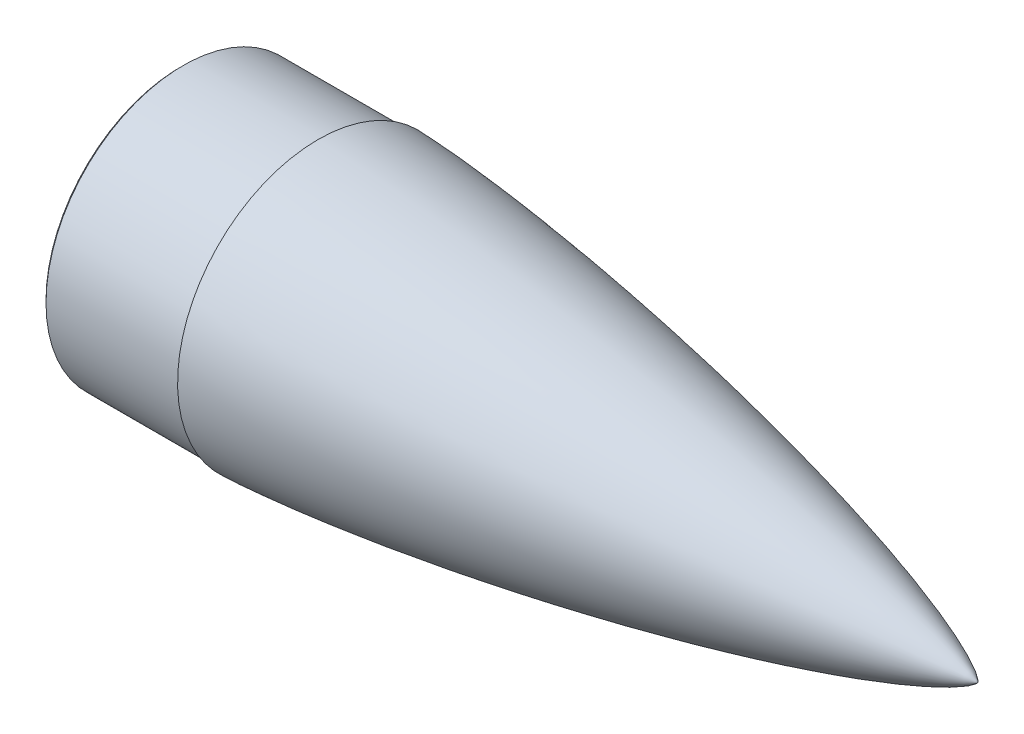
from build123d import *

# Parameters (mm, degrees)
CHAMFER1_SIZE     = 1.5
CIRPATTERN1_COUNT = 6


with BuildPart() as part:
    # Sketch10 → Revolve1 (revolve)
    with BuildSketch(Plane.XY, mode=Mode.PRIVATE) as revolve1_sk:
        with BuildLine():
            Line((11.112493743, 81.99983), (11.112493743, 67.49983))
            Line((11.112493743, 67.49983), (129.304508698, 67.49983))
            add(Edge.make_bspline(
                [(368.967251823, 0), (368.965299543, 0.012338489), (368.959416882, 0.036518378), (368.940636147, 0.082964007), (368.902304552, 0.158736421), (368.845538097, 0.250270687), (368.755690124, 0.376555746), (368.616653262, 0.54835284), (368.392888737, 0.793577299), (368.008659121, 1.164904965), (367.344738263, 1.729853685), (366.176060796, 2.601559154), (364.09282389, 3.960032328), (360.425978756, 6.040734396), (354.402196649, 9.01831007), (344.042994901, 13.507695011), (329.152005398, 19.128483965), (310.425167902, 25.398569259), (288.741266406, 31.933693508), (266.378532845, 38.106125474), (243.901379123, 43.846895186), (221.331994001, 49.212017941), (198.683967629, 54.234500927), (175.966897581, 58.934255644), (156.034567874, 62.771715365), (141.509051931, 65.395628269), (132.679425236, 66.924517444), (129.562757302, 67.455859883), (129.304508698, 67.49983)],
                knots=[0, 0, 0, 0, 0, 0.000134949, 0.000269899, 0.000539798, 0.000919537, 0.001299277, 0.001947431, 0.00293136, 0.004511869, 0.007081312, 0.011380263, 0.018707867, 0.031423867, 0.052705479, 0.084103008, 0.140910136, 0.203703492, 0.266497064, 0.329290816, 0.392084375, 0.454877964, 0.517671564, 0.580465191, 0.643258828, 0.674655593, 0.677492072, 0.677492072, 0.677492072, 0.677492072, 0.677492072], degree=4))
            Line((368.967251823, 0), (408.967251823, 0))
            add(Edge.make_bspline(
                [(408.967251823, 0), (408.964913524, 0.013501739), (408.958040758, 0.039916077), (408.936520441, 0.090485698), (408.892222076, 0.174057132), (408.826281575, 0.275556803), (408.721696416, 0.415833756), (408.561101809, 0.605075245), (408.30561918, 0.87242415), (407.86966713, 1.275299562), (407.120955138, 1.885142115), (405.803773451, 2.82590185), (403.46240692, 4.287152794), (399.325294488, 6.531818454), (392.481146888, 9.758904649), (380.662076725, 14.628008466), (363.637187185, 20.711720382), (342.215241093, 27.476512989), (317.428462321, 34.49762647), (291.879335737, 41.10482439), (266.21046092, 47.228993169), (240.44548836, 52.933436777), (214.598861982, 58.255439009), (188.68089566, 63.217582693), (165.946174917, 67.253280679), (146.421982586, 70.493799722), (130.127893898, 73.044947468), (117.078590637, 74.994157933), (104.015464216, 76.84854079), (92.573263959, 78.384492045), (82.757139441, 79.635603973), (74.571340184, 80.632219902), (68.019260454, 81.400804211), (61.463723364, 82.139375899), (54.90469802, 82.84637726), (48.342159918, 83.519940506), (41.776057559, 84.15778717), (36.02754108, 84.682157239), (31.097921259, 85.105234912), (26.988317923, 85.438669825), (23.699666618, 85.693218594), (20.085807822, 85.958448038), (16.719873821, 86.189018485), (13.602098287, 86.386966779), (10.732704013, 86.554575744), (8.436635008, 86.678703291), (6.139997341, 86.792157585), (4.129892063, 86.879313264), (2.40653858, 86.944618982), (1.257348635, 86.979022496), (0.68269791, 86.99491462), (0.395312527, 86.99983)],
                knots=[0, 0, 0, 0, 0, 0.000130123, 0.000260245, 0.000520491, 0.000900391, 0.00128029, 0.001925099, 0.002881508, 0.004418208, 0.006927086, 0.011110697, 0.018279138, 0.03067276, 0.051704469, 0.08310228, 0.139908797, 0.202702513, 0.265496165, 0.328289682, 0.391083359, 0.453876973, 0.516670577, 0.579464197, 0.642257765, 0.673654596, 0.705051427, 0.736448267, 0.767845106, 0.799241874, 0.814940257, 0.830638641, 0.846337073, 0.862035505, 0.877733936, 0.893432368, 0.90913072, 0.924829072, 0.932678248, 0.940527424, 0.9483766, 0.956225776, 0.967169332, 0.97264111, 0.978112888, 0.983584666, 0.989056444, 0.994528222, 0.997264111, 1, 1, 1, 1, 1], degree=4))
            Line((0.395312527, 86.99983), (0.395312527, 84.99983))
            Line((0.395312527, 84.99983), (-84.604517473, 84.99983))
            Line((-84.604517473, 84.99983), (-84.604517473, 81.99983))
            Line((-84.604517473, 81.99983), (11.112493743, 81.99983))
        make_face()
    revolve(revolve1_sk.sketch.rotate(Axis((46.917858469, 0, 0), (-1, 0, 0)), 90), axis=Axis((46.917858469, 0, 0), (-1, 0, 0)))

    # Chamfer1
    chamfer1_edges = [part.edges().sort_by_distance(p)[0] for p in [
        (-84.604517473, 0, 84.99983),
    ]]
    chamfer(chamfer1_edges, length=CHAMFER1_SIZE)

    # Sketch18 → Tapped Hole for M4x0.7 Helicoil1 (revolve, cut)
    with BuildSketch(Plane(origin=(11.112493743, 64.735251709, -37.374915), x_dir=(0, 0, 1), z_dir=(0, 1, 0))):
        Polygon((0, 0), (0, 31.2618073), (2.1, 30), (2.1, 0), align=None)
    tapped_hole_for_m4x0_7_helicoil1 = revolve(axis=Axis((4.762493743, 64.735251709, -37.374915), (1, 0, 0)), mode=Mode.SUBTRACT)

    # CirPattern1: Tapped Hole for M4x0.7 Helicoil1 ×6 about axis
    cirpattern1_axis = Axis((0, 0, 0), (1, 0, 0))
    for i in range(1, CIRPATTERN1_COUNT):
        add(tapped_hole_for_m4x0_7_helicoil1.rotate(cirpattern1_axis, i * 360 / CIRPATTERN1_COUNT), mode=Mode.SUBTRACT)


solid = part.part
